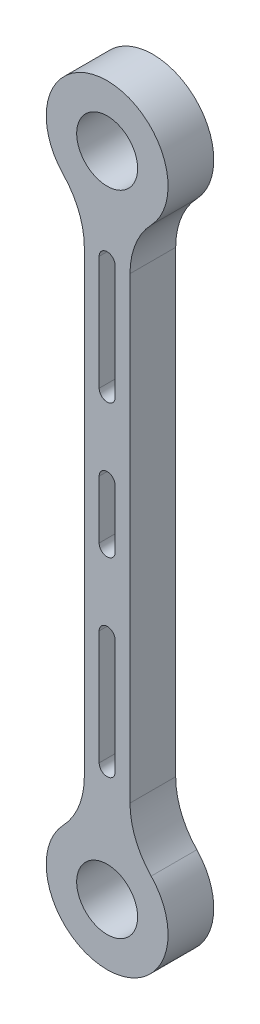
from build123d import *

# Parameters (mm, degrees)
SKETCH_1_R      = 8
SKETCH_1_R_2    = 4
EXTRUDE_1_DEPTH = 6
FILLET_1_R      = 10


with BuildPart() as part:
    # 草图1 → 凸台-拉伸1 (new body)
    # profile 1 of 3: a face of its own
    with BuildSketch(Plane.XY):
        with BuildLine():
            ThreePointArc((3, -7.416198487), (0, -8), (-3, -7.416198487))
            Line((-3, -7.416198487), (-3, -77.683801513))
            ThreePointArc((-3, -77.683801513), (0, -77.1), (3, -77.683801513))
            Line((3, -77.683801513), (3, -7.416198487))
        make_face()
        with BuildLine():
            ThreePointArc((-1.05, -55.1), (0, -54.05), (1.05, -55.1))
            Line((1.05, -55.1), (1.05, -70.1))
            ThreePointArc((1.05, -70.1), (0, -71.15), (-1.05, -70.1))
            Line((-1.05, -70.1), (-1.05, -55.1))
        make_face(mode=Mode.SUBTRACT)
        with BuildLine():
            ThreePointArc((-1.05, -37.5), (0, -36.45), (1.05, -37.5))
            Line((1.05, -37.5), (1.05, -45.1))
            ThreePointArc((1.05, -45.1), (0, -46.15), (-1.05, -45.1))
            Line((-1.05, -45.1), (-1.05, -37.5))
        make_face(mode=Mode.SUBTRACT)
        with BuildLine():
            ThreePointArc((-1.05, -12.5), (0, -11.45), (1.05, -12.5))
            Line((1.05, -12.5), (1.05, -27.5))
            ThreePointArc((1.05, -27.5), (0, -28.55), (-1.05, -27.5))
            Line((-1.05, -27.5), (-1.05, -12.5))
        make_face(mode=Mode.SUBTRACT)
    # profile 2 of 3: a face of its own
    with BuildSketch(Plane.XY):
        Circle(SKETCH_1_R)
        Circle(SKETCH_1_R_2, mode=Mode.SUBTRACT)
    # profile 3 of 3: a face of its own
    with BuildSketch(Plane.XY):
        with Locations((0, -85.1)):
            Circle(SKETCH_1_R)
        with Locations((0, -85.1)):
            Circle(SKETCH_1_R_2, mode=Mode.SUBTRACT)
    extrude(amount=EXTRUDE_1_DEPTH)

    # 圆角1
    fillet_1_edges = [part.edges().sort_by_distance(p)[0] for p in [
        (3, -77.683801513, 3),
        (-3, -77.683801513, 3),
        (-3, -7.416198487, 3),
        (3, -7.416198487, 3),
    ]]
    fillet(fillet_1_edges, radius=FILLET_1_R)


solid = part.part
